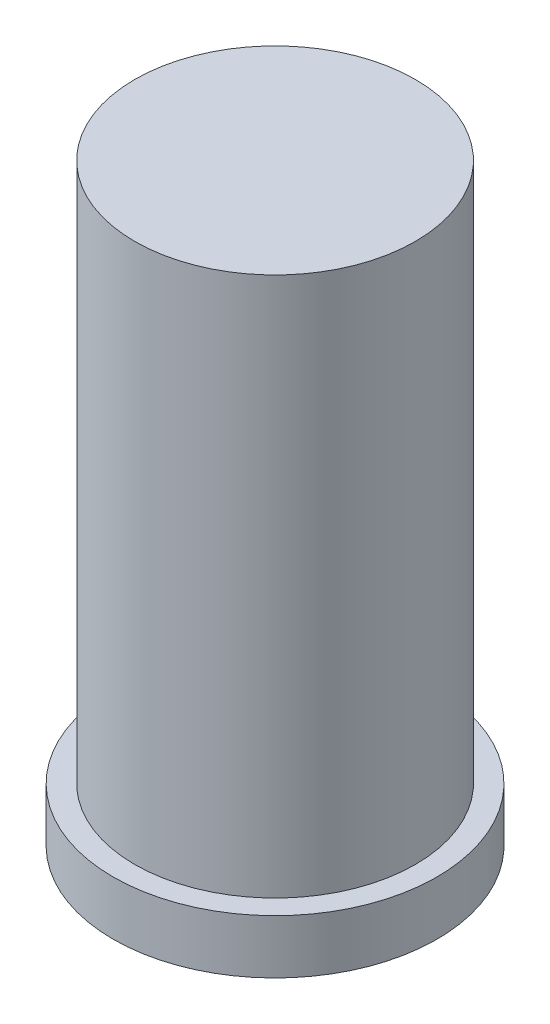
from build123d import *

# Parameters (mm, degrees)
SKETCH1_R           = 1.5
BOSS_EXTRUDE1_DEPTH = 0.5
SKETCH2_R           = 1.3
BOSS_EXTRUDE2_DEPTH = 5


with BuildPart() as part:
    # Sketch1 → Boss-Extrude1 (new body)
    with BuildSketch(Plane(origin=(0, 0, 0), x_dir=(1, 0, 0), z_dir=(0, 1, 0))):
        with Locations(Location((0, 0, 0), (0, 0, 270))):
            Circle(SKETCH1_R)
    extrude(amount=BOSS_EXTRUDE1_DEPTH)

    # Sketch2 → Boss-Extrude2 (add)
    with BuildSketch(Plane(origin=(0, 0.5, 0), x_dir=(1, 0, 0), z_dir=(0, 1, 0))):
        with Locations(Location((0, 0, 0), (0, 0, 270))):
            Circle(SKETCH2_R)
    extrude(amount=BOSS_EXTRUDE2_DEPTH)


solid = part.part
